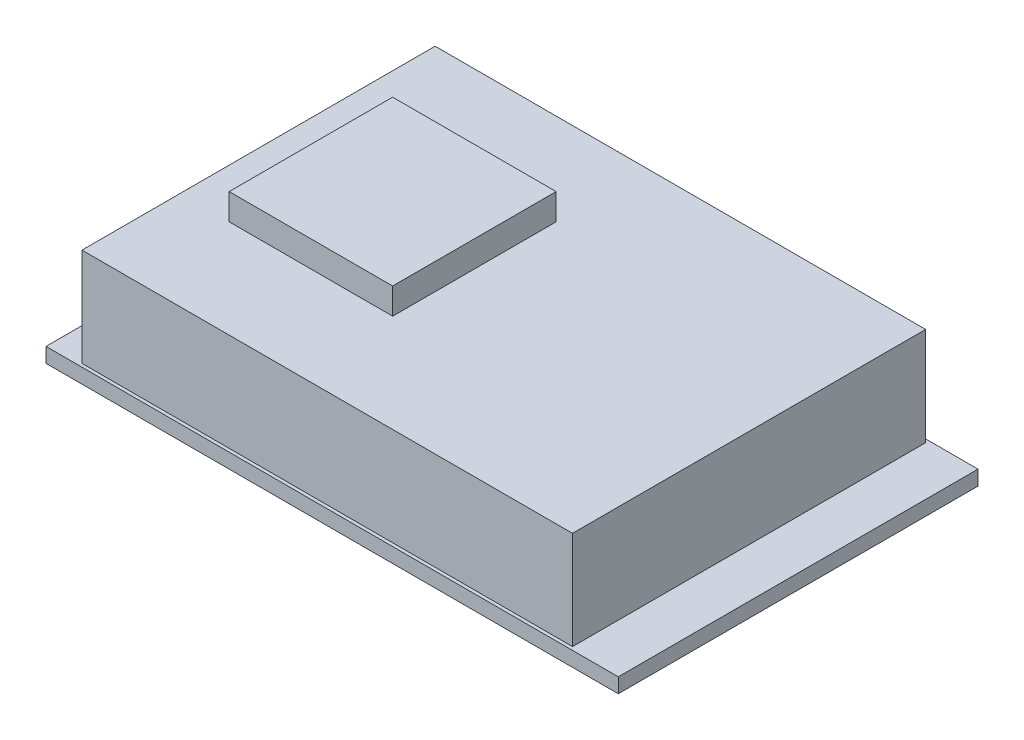
from build123d import *

# Parameters (mm, degrees)
SKETCH1_W           = 175
SKETCH1_H           = 110
BOSS_EXTRUDE1_DEPTH = 4.5
SKETCH2_W           = 150
SKETCH2_H           = 108
BOSS_EXTRUDE2_DEPTH = 30
SKETCH3_W           = 50
SKETCH3_H           = 50
BOSS_EXTRUDE3_DEPTH = 8


with BuildPart() as part:
    # Sketch1 → Boss-Extrude1 (new body)
    with BuildSketch(Plane(origin=(0, 0, 0), x_dir=(1, 0, 0), z_dir=(0, 1, 0))):
        Rectangle(SKETCH1_W, SKETCH1_H)
    extrude(amount=BOSS_EXTRUDE1_DEPTH)

    # Sketch2 → Boss-Extrude2 (add)
    with BuildSketch(Plane(origin=(0, 4.5, 0), x_dir=(1, 0, 0), z_dir=(0, 1, 0))):
        with Locations((-2.5, 0)):
            Rectangle(SKETCH2_W, SKETCH2_H)
    extrude(amount=BOSS_EXTRUDE2_DEPTH)

    # Sketch3 → Boss-Extrude3 (add)
    with BuildSketch(Plane(origin=(0, 34.5, 0), x_dir=(1, 0, 0), z_dir=(0, 1, 0))):
        with Locations((-37.5, 1)):
            Rectangle(SKETCH3_W, SKETCH3_H)
    extrude(amount=BOSS_EXTRUDE3_DEPTH)


solid = part.part
